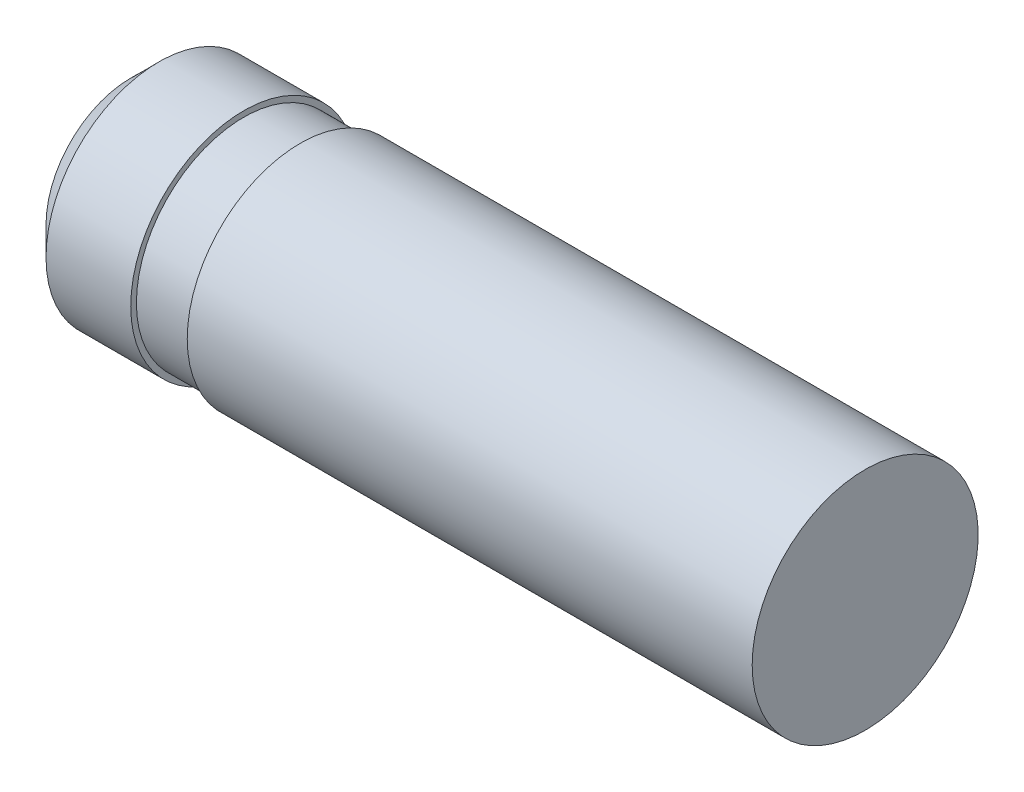
from build123d import *

# Parameters (mm, degrees)
CHAMFER1_SIZE = 0.5


with BuildPart() as part:
    # Sketch1 → Revolve1 (revolve)
    with BuildSketch(Plane.XY, mode=Mode.PRIVATE) as revolve1_sk:
        Polygon((4.563829787, -2), (-5.436170213, -2), (-5.436170213, -1.9), (-6.436170213, -1.9), (-6.436170213, -2), (-8.436170213, -2), (-8.436170213, 0), (4.563829787, 0), align=None)
    revolve(revolve1_sk.sketch.rotate(Axis((-11.444148936, 0, 0), (1, 0, 0)), 270), axis=Axis((-11.444148936, 0, 0), (1, 0, 0)))

    # Chamfer1
    chamfer1_edges = [part.edges().sort_by_distance(p)[0] for p in [
        (-8.436170213, 0, -2),
    ]]
    chamfer(chamfer1_edges, length=CHAMFER1_SIZE)


solid = part.part
